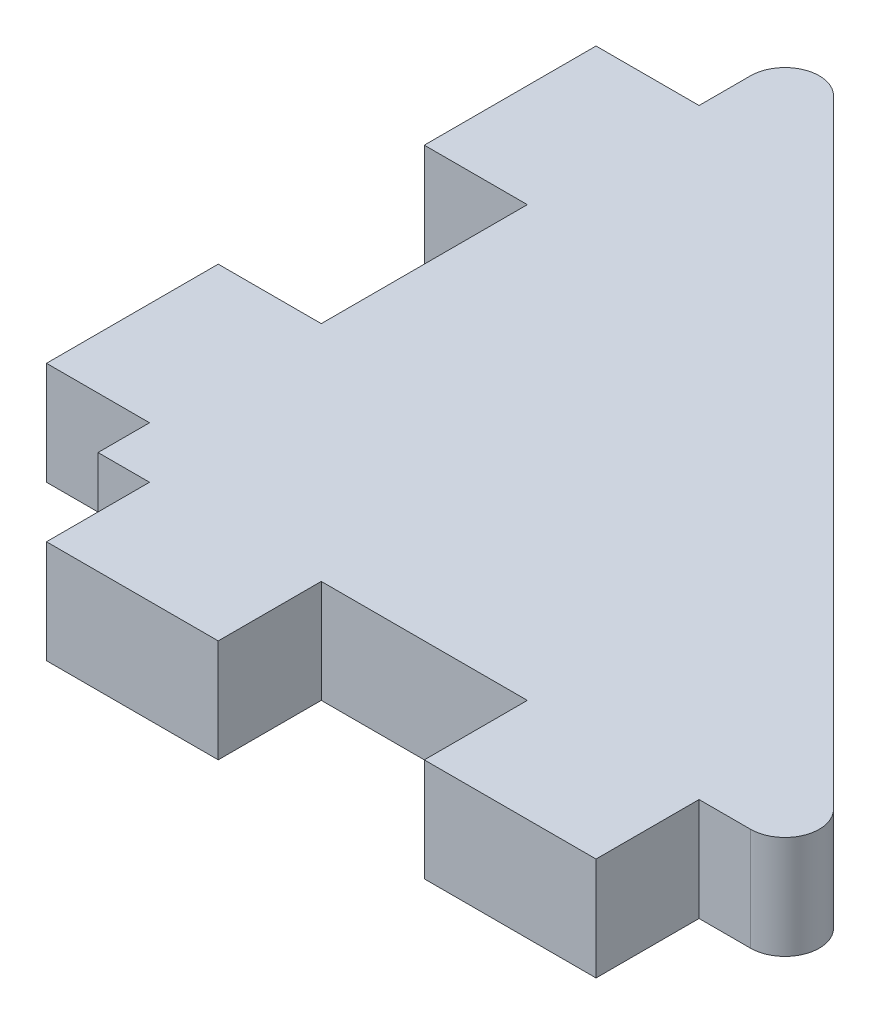
from build123d import *

# Parameters (mm, degrees)
BOSS_EXTRUDE1_DEPTH = 6


with BuildPart() as part:
    # Sketch2 → Boss-Extrude1 (new body)
    with BuildSketch(Plane(origin=(0, 0, 0), x_dir=(1, 0, 0), z_dir=(0, 1, 0))):
        with BuildLine():
            Line((-38.998907426, 19.146898027), (-2.998907426, -16.853101973))
            ThreePointArc((-2.998907426, -16.853101973), (-2.565361924, -19.0326824), (-4.413120989, -20.267315535))
            Line((-4.413120989, -20.267315535), (-7.413120989, -20.267315535))
            Line((-7.413120989, -20.267315535), (-7.413120989, -26.267315535))
            Line((-7.413120989, -26.267315535), (-17.413120989, -26.267315535))
            Line((-17.413120989, -26.267315535), (-17.413120989, -20.267315535))
            Line((-17.413120989, -20.267315535), (-29.413120989, -20.267315535))
            Line((-29.413120989, -20.267315535), (-29.413120989, -26.267315535))
            Line((-29.413120989, -26.267315535), (-39.413120989, -26.267315535))
            Line((-39.413120989, -26.267315535), (-39.413120989, -20.267315535))
            Line((-39.413120989, -20.267315535), (-42.413120989, -20.267315535))
            Line((-42.413120989, -20.267315535), (-42.413120989, -17.267315535))
            Line((-42.413120989, -17.267315535), (-48.413120989, -17.267315535))
            Line((-48.413120989, -17.267315535), (-48.413120989, -7.267315535))
            Line((-48.413120989, -7.267315535), (-42.413120989, -7.267315535))
            Line((-42.413120989, -7.267315535), (-42.413120989, 4.732684465))
            Line((-42.413120989, 4.732684465), (-48.413120989, 4.732684465))
            Line((-48.413120989, 4.732684465), (-48.413120989, 14.732684465))
            Line((-48.413120989, 14.732684465), (-42.413120989, 14.732684465))
            Line((-42.413120989, 14.732684465), (-42.413120989, 17.732684465))
            ThreePointArc((-42.413120989, 17.732684465), (-41.178487854, 19.58044353), (-38.998907426, 19.146898027))
        make_face()
    extrude(amount=BOSS_EXTRUDE1_DEPTH)


solid = part.part
